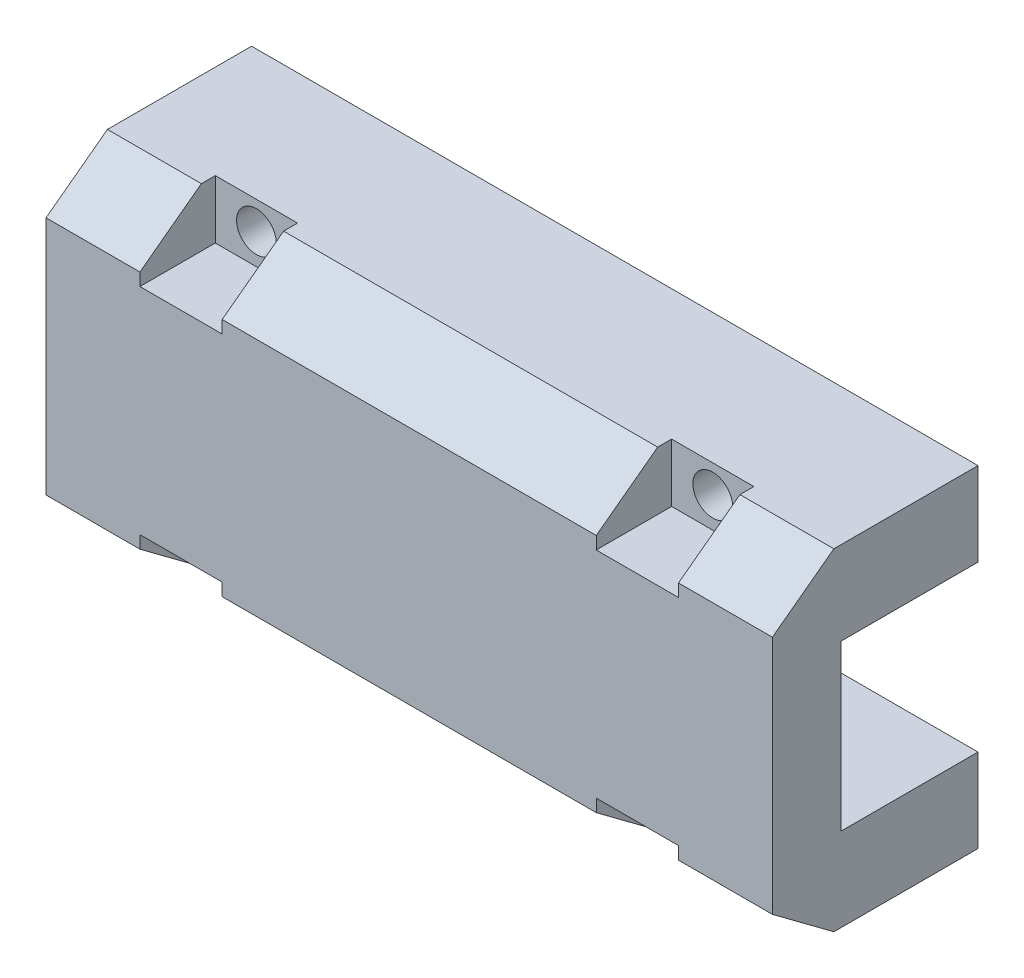
from build123d import *

# Parameters (mm, degrees)
CROQUIS1_W                = 53
CROQUIS1_H                = 6.1
SALIENTE_EXTRUIR1_DEPTH   = 10
SALIENTE_EXTRUIR1_2_DEPTH = 10
CROQUIS2_W                = 53
CROQUIS2_H                = 24.2
SALIENTE_EXTRUIR2_DEPTH   = 5
CORTAR_EXTRUIR1_DEPTH     = 100
CROQUIS4_W                = 19.5
CROQUIS4_H                = 3.2
CORTAR_EXTRUIR2_DEPTH     = 10
CROQUIS5_W                = 6
CROQUIS5_H                = 4.263570071
CROQUIS5_H_2              = 4.260183182
CORTAR_EXTRUIR3_DEPTH     = 5.5
CROQUIS6_R                = 1.45
CORTAR_EXTRUIR4_DEPTH     = 20


with BuildPart() as part:
    # Croquis1 → Saliente-Extruir1 (new body)
    with BuildSketch(Plane.XY):
        with Locations((-1.118469745, -8.924349429)):
            Rectangle(CROQUIS1_W, CROQUIS1_H)
    extrude(amount=SALIENTE_EXTRUIR1_DEPTH)



with BuildPart() as body_2:
    # Croquis1 → Saliente-Extruir1 2 (new body)
    with BuildSketch(Plane.XY):
        with Locations((-1.118469745, -27.024349429)):
            Rectangle(CROQUIS1_W, CROQUIS1_H)
    extrude(amount=SALIENTE_EXTRUIR1_2_DEPTH)


with BuildPart() as part_1:
    add(part.part)

    add(body_2.part)  # Saliente-Extruir2 merges body 2
    # Croquis2 → Saliente-Extruir2 (add)
    with BuildSketch(Plane.XY.offset(10)):
        with Locations((-1.118469745, -17.974349429)):
            Rectangle(CROQUIS2_W, CROQUIS2_H)
    extrude(amount=SALIENTE_EXTRUIR2_DEPTH)

    # Croquis3 → Cortar-Extruir1 (cut)
    with BuildSketch(Plane.ZY.offset(27.618469745)):
        Polygon((10.51738062, -5.874349429), (15, -9.216602222), (15, -5.874349429), align=None)
        Polygon((15, -26.732096635), (15, -30.074349429), (10.51738062, -30.074349429), align=None)
    extrude(amount=-CORTAR_EXTRUIR1_DEPTH, mode=Mode.SUBTRACT)

    # Croquis4 → Cortar-Extruir2 (cut)
    with BuildSketch(Plane.XZ.offset(30.074349429)):
        with Locations((-1.118469745, 1.6)):
            Rectangle(CROQUIS4_W, CROQUIS4_H)
    extrude(amount=-CORTAR_EXTRUIR2_DEPTH, mode=Mode.SUBTRACT)

    # Croquis5 → Cortar-Extruir3 (cut)
    with BuildSketch(Plane.XY.offset(15)):
        with Locations((-17.765649999, -27.942564393)):
            Rectangle(CROQUIS5_W, CROQUIS5_H)
        with Locations((-17.765649999, -8.00444102)):
            Rectangle(CROQUIS5_W, CROQUIS5_H_2)
        with Locations((15.528710509, -27.942564393)):
            Rectangle(CROQUIS5_W, CROQUIS5_H)
        with Locations((15.528710509, -8.00444102)):
            Rectangle(CROQUIS5_W, CROQUIS5_H_2)
    extrude(amount=-CORTAR_EXTRUIR3_DEPTH, mode=Mode.SUBTRACT)

    # Croquis6 → Cortar-Extruir4 (cut)
    with BuildSketch(Plane.XY.offset(9.5)):
        with Locations((-17.765649999, -7.915512161)):
            Circle(CROQUIS6_R)
        with Locations((15.528710509, -7.915512161)):
            Circle(CROQUIS6_R)
        with Locations((15.528710509, -28.033186696)):
            Circle(CROQUIS6_R)
        with Locations((-17.765649999, -28.033186696)):
            Circle(CROQUIS6_R)
    extrude(amount=-CORTAR_EXTRUIR4_DEPTH, mode=Mode.SUBTRACT)


solid = part_1.part
